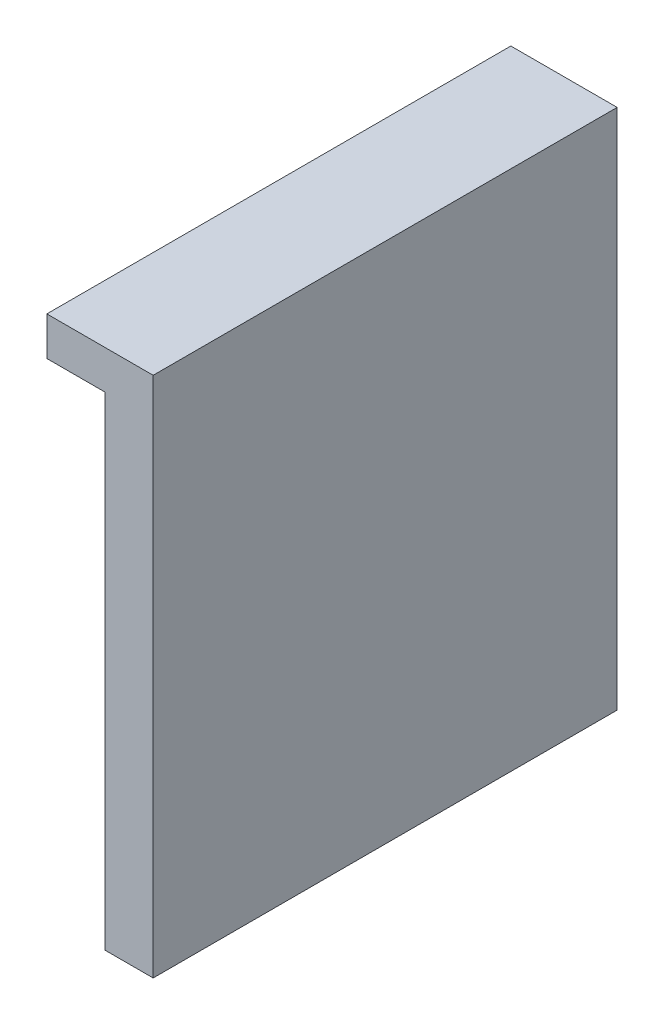
from build123d import *

# Parameters (mm, degrees)
SKETCH1_W           = 3
SKETCH1_H           = 24
BOSS_EXTRUDE1_DEPTH = 23
SKETCH2_W           = 6
SKETCH2_H           = 24
BOSS_EXTRUDE2_DEPTH = 2
SKETCH4_W           = 3
SKETCH4_H           = 24
BOSS_EXTRUDE3_DEPTH = 2
SKETCH5_W           = 24
SKETCH5_H           = 27
CUT_EXTRUDE1_DEPTH  = 0.5


with BuildPart() as part:
    # Sketch1 → Boss-Extrude1 (new body)
    with BuildSketch(Plane(origin=(0, 0, 0), x_dir=(1, 0, 0), z_dir=(0, 1, 0))):
        with Locations((1.5, 12)):
            Rectangle(SKETCH1_W, SKETCH1_H)
    extrude(amount=BOSS_EXTRUDE1_DEPTH)

    # Sketch2 → Boss-Extrude2 (add)
    with BuildSketch(Plane(origin=(0, 23, 0), x_dir=(1, 0, 0), z_dir=(0, 1, 0))):
        with Locations((0, 12)):
            Rectangle(SKETCH2_W, SKETCH2_H)
    extrude(amount=BOSS_EXTRUDE2_DEPTH)

    # Sketch4 → Boss-Extrude3 (add)
    with BuildSketch(Plane.XZ):
        with Locations((1.5, -12)):
            Rectangle(SKETCH4_W, SKETCH4_H)
    extrude(amount=BOSS_EXTRUDE3_DEPTH)

    # Sketch5 → Cut-Extrude1 (cut)
    with BuildSketch(Plane(origin=(3, 0, 0), x_dir=(0, 0, -1), z_dir=(1, 0, 0))):
        with Locations((12, 11.5)):
            Rectangle(SKETCH5_W, SKETCH5_H)
    extrude(amount=-CUT_EXTRUDE1_DEPTH, mode=Mode.SUBTRACT)


solid = part.part
